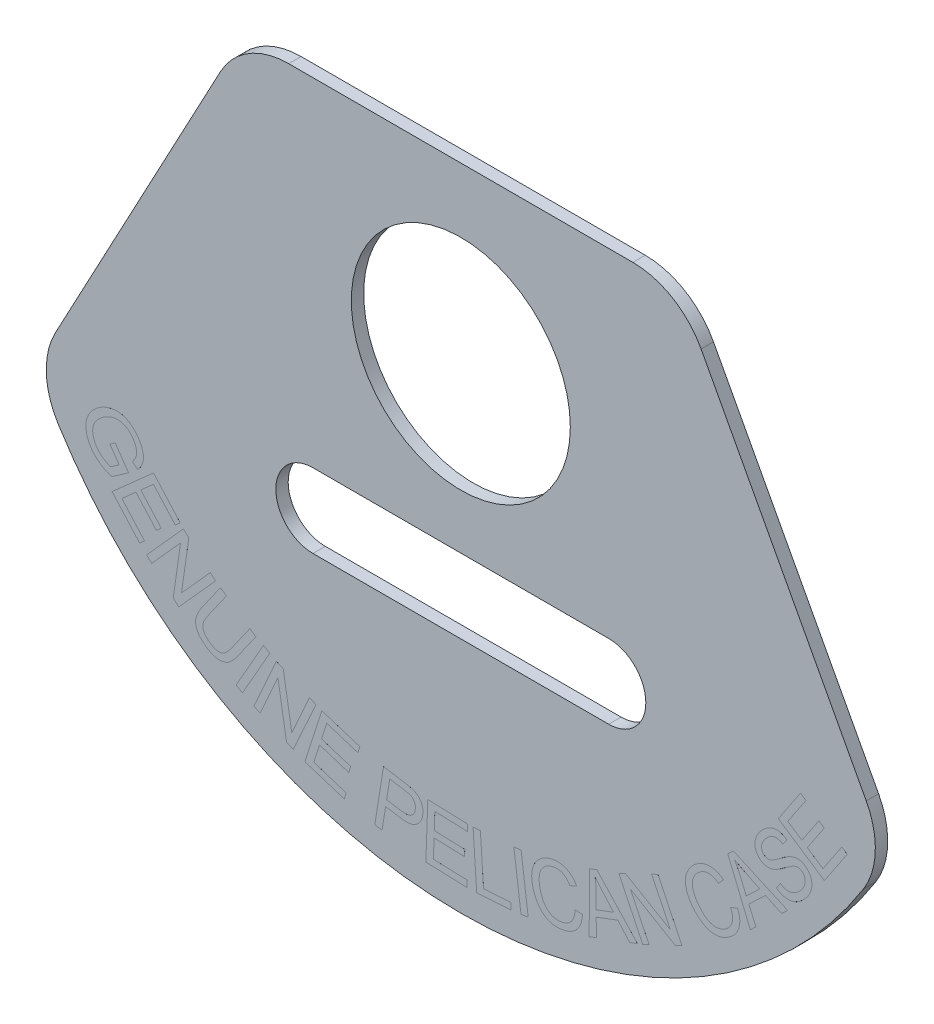
from build123d import *

# Parameters (mm, degrees)
SKETCH1_R      = 4.4958
EXTRUDE1_DEPTH = 0.508
FILLET1_R      = 3.175
EXTRUDE2_DEPTH = 0.0001016


with BuildPart() as part:
    # Sketch1 → Extrude1 (new body)
    with BuildSketch(Plane.XY):
        with BuildLine():
            Line((-8.9662, 7.1374), (8.9662, 7.1374))
            Line((8.9662, 7.1374), (17.4625, -8.751203146))
            ThreePointArc((17.4625, -8.751203146), (0, -19.5326), (-17.4625, -8.751203146))
            Line((-17.4625, -8.751203146), (-8.9662, 7.1374))
        make_face()
        Circle(SKETCH1_R, mode=Mode.SUBTRACT)
        with BuildLine():
            Line((-6.0706, -9.779), (6.0706, -9.779))
            ThreePointArc((6.0706, -9.779), (7.5946, -8.255), (6.0706, -6.731))
            Line((6.0706, -6.731), (-6.0706, -6.731))
            ThreePointArc((-6.0706, -6.731), (-7.5946, -8.255), (-6.0706, -9.779))
        make_face(mode=Mode.SUBTRACT)
    extrude(amount=EXTRUDE1_DEPTH)

    # Fillet1
    fillet1_edges = [part.edges().sort_by_distance(p)[0] for p in [
        (-8.9662, 7.1374, 0.254),
        (8.9662, 7.1374, 0.254),
        (17.4625, -8.751203146, 0.254),
        (-17.4625, -8.751203146, 0.254),
    ]]
    fillet(fillet1_edges, radius=FILLET1_R)

    # Sketch2 → Extrude2 (add)
    # profile 1 of 18: a face of its own
    with BuildSketch(Plane.XY.offset(0.508)):
        with BuildLine():
            Line((-14.405339403, -10.058231939), (-14.185989643, -9.906198285))
            Line((-14.185989643, -9.906198285), (-13.637386278, -10.697048045))
            Line((-13.637386278, -10.697048045), (-14.330238442, -11.176503574))
            add(Edge.make_bspline(
                [(-14.330238442, -11.176503574), (-14.374317038, -11.162431883), (-14.461095163, -11.134728755), (-14.584628046, -11.08119479), (-14.701253634, -11.022163996), (-14.809199189, -10.954077311), (-14.908909301, -10.878158018), (-15.000914825, -10.795215031), (-15.084475824, -10.704335145), (-15.13297946, -10.638144671), (-15.157264884, -10.605003574)],
                knots=[0, 0, 0, 0, 1.082828154, 2.131778334, 3.148468589, 4.141125326, 5.115499049, 6.079637879, 7.038488401, 8, 8, 8, 8], degree=3))
            add(Edge.make_bspline(
                [(-15.157264884, -10.605003574), (-15.172667622, -10.582138048), (-15.20312692, -10.536920903), (-15.243383735, -10.466407882), (-15.27911171, -10.395213103), (-15.310007636, -10.322872484), (-15.336036317, -10.249586481), (-15.357789537, -10.175346042), (-15.374096109, -10.100014745), (-15.386244522, -10.024224904), (-15.392589965, -9.948455948), (-15.393549061, -9.873469325), (-15.389109571, -9.799494471), (-15.37851616, -9.726773966), (-15.362326661, -9.655310303), (-15.340828579, -9.584953959), (-15.313207725, -9.515832174), (-15.280210241, -9.448082287), (-15.24215693, -9.382295981), (-15.199870647, -9.318704936), (-15.154230986, -9.256953391), (-15.103480356, -9.198427879), (-15.049113219, -9.141933601), (-14.990169046, -9.088549238), (-14.927870718, -9.03670423), (-14.883478591, -9.005016951), (-14.860982432, -8.988959103)],
                knots=[0, 0, 0, 0, 1.071349796, 2.118620868, 3.153497963, 4.166333753, 5.174134211, 6.174993909, 7.171252578, 8.168217763, 9.156671421, 10.123900765, 11.081031277, 12.034273283, 12.977117325, 13.926807141, 14.890901093, 15.867458189, 16.85364755, 17.842688721, 18.834768701, 19.836173477, 20.851647588, 21.880605348, 22.925975333, 24, 24, 24, 24], degree=3))
            add(Edge.make_bspline(
                [(-14.860982432, -8.988959103), (-14.838241078, -8.973756356), (-14.79303418, -8.943535242), (-14.722888771, -8.902783183), (-14.651236151, -8.866621054), (-14.578439378, -8.834353689), (-14.504015942, -8.806989637), (-14.428566913, -8.783497182), (-14.35160695, -8.764742502), (-14.273986089, -8.750109715), (-14.196322699, -8.740289218), (-14.119607683, -8.736495822), (-14.044642593, -8.73908451), (-13.971183342, -8.745907687), (-13.899618063, -8.760097218), (-13.829358216, -8.779085421), (-13.760986975, -8.804506533), (-13.694499435, -8.835328036), (-13.62976656, -8.871141988), (-13.567274208, -8.911826977), (-13.506952469, -8.957068073), (-13.448683797, -9.006464169), (-13.392971736, -9.060849864), (-13.338522939, -9.118841111), (-13.287422938, -9.182343278), (-13.255270108, -9.226936518), (-13.238984836, -9.249522805)],
                knots=[0, 0, 0, 0, 1.06109204, 2.109315031, 3.144864666, 4.173686793, 5.1967489, 6.219502437, 7.237857309, 8.268110154, 9.282514121, 10.272633808, 11.244304441, 12.1906689, 13.131439513, 14.071035106, 15.011619306, 15.957557495, 16.911819532, 17.879312396, 18.848163653, 19.835445603, 20.84059366, 21.867231811, 22.919761968, 24, 24, 24, 24], degree=3))
            add(Edge.make_bspline(
                [(-13.238984836, -9.249522805), (-13.217026873, -9.283052671), (-13.173964625, -9.348808837), (-13.120628801, -9.451534592), (-13.079592915, -9.555524793), (-13.049706613, -9.659142756), (-13.032087419, -9.761288222), (-13.026717651, -9.85985298), (-13.033741207, -9.954355959), (-13.054325775, -10.045318008), (-13.088376107, -10.133897693), (-13.134144469, -10.222427494), (-13.193315193, -10.311207936), (-13.240268109, -10.367760507), (-13.264629067, -10.397102132)],
                knots=[0, 0, 0, 0, 1.149350684, 2.25401714, 3.313617248, 4.351853787, 5.34248913, 6.280872132, 7.176969563, 8.052379664, 8.946259361, 9.892254739, 10.906421622, 12, 12, 12, 12], degree=3))
            Line((-13.264629067, -10.397102132), (-13.479399499, -10.216676651))
            add(Edge.make_bspline(
                [(-13.479399499, -10.216676651), (-13.461801722, -10.19387973), (-13.428130687, -10.150260817), (-13.385422093, -10.083860239), (-13.351787839, -10.020243482), (-13.32718509, -9.95817553), (-13.311252187, -9.895111236), (-13.305935452, -9.829054408), (-13.308081069, -9.759383655), (-13.319990733, -9.686962008), (-13.339596025, -9.612977897), (-13.367464427, -9.539147362), (-13.404577496, -9.466599632), (-13.434696951, -9.420526392), (-13.450091807, -9.396977132)],
                knots=[0, 0, 0, 0, 1.158737033, 2.217091143, 3.173407836, 4.050779318, 4.898657467, 5.780855778, 6.70909061, 7.697969566, 8.727743783, 9.785527082, 10.868123942, 12, 12, 12, 12], degree=3))
            add(Edge.make_bspline(
                [(-13.450091807, -9.396977132), (-13.469627725, -9.370055371), (-13.5074582, -9.317922525), (-13.569957717, -9.248079516), (-13.634766855, -9.188233913), (-13.702210746, -9.139197982), (-13.770955253, -9.099760411), (-13.839379402, -9.068072665), (-13.908566817, -9.046412839), (-13.977288973, -9.033135637), (-14.045440377, -9.027553293), (-14.112663789, -9.026877872), (-14.179066577, -9.032202317), (-14.222527739, -9.040327273), (-14.244147095, -9.044368959)],
                knots=[0, 0, 0, 0, 1.290977427, 2.49992288, 3.632681347, 4.710382453, 5.730109379, 6.70630512, 7.632375366, 8.53794066, 9.418565077, 10.283977416, 11.146380324, 12, 12, 12, 12], degree=3))
            add(Edge.make_bspline(
                [(-14.244147095, -9.044368959), (-14.281039209, -9.053463158), (-14.355321615, -9.071774362), (-14.462890006, -9.114677234), (-14.56889642, -9.166964712), (-14.635346164, -9.210776755), (-14.669108634, -9.233037228)],
                knots=[0, 0, 0, 0, 0.973568992, 1.960284718, 2.963640486, 4, 4, 4, 4], degree=3))
            add(Edge.make_bspline(
                [(-14.669108634, -9.233037228), (-14.689434119, -9.247302802), (-14.729317086, -9.275294921), (-14.784889378, -9.320395839), (-14.836695517, -9.365758157), (-14.883593821, -9.412423027), (-14.92671287, -9.459597278), (-14.964443858, -9.508333401), (-14.998851339, -9.55733808), (-15.028004752, -9.607707115), (-15.052830424, -9.658724699), (-15.073556527, -9.710267755), (-15.090313132, -9.762352422), (-15.101551631, -9.815334979), (-15.108950095, -9.868592661), (-15.112261086, -9.922489194), (-15.110864999, -9.977031528), (-15.102691309, -10.050028258), (-15.083680144, -10.139773079), (-15.049869142, -10.244115524), (-15.003407426, -10.343892737), (-14.963821278, -10.405759108), (-14.943868249, -10.436942276)],
                knots=[0, 0, 0, 0, 1.063172158, 2.086172138, 3.063384936, 4.011024092, 4.91822726, 5.798339324, 6.648817758, 7.480778533, 8.287732388, 9.076799311, 9.858328981, 10.627678796, 11.393186153, 12.159418925, 12.937605783, 13.726672705, 15.302380997, 16.856996345, 18.415798284, 20, 20, 20, 20], degree=3))
            add(Edge.make_bspline(
                [(-14.943868249, -10.436942276), (-14.924694115, -10.463007968), (-14.886306356, -10.515193037), (-14.819270568, -10.586005485), (-14.745815735, -10.651014015), (-14.666665668, -10.707810363), (-14.587171519, -10.75689783), (-14.511146086, -10.796634682), (-14.441017728, -10.828285524), (-14.3946764, -10.841484502), (-14.372826182, -10.847707901)],
                knots=[0, 0, 0, 0, 1.083356329, 2.16894396, 3.259712218, 4.365640272, 5.428827185, 6.387401207, 7.239649868, 8, 8, 8, 8], degree=3))
            Line((-14.372826182, -10.847707901), (-14.025255268, -10.607293237))
            Line((-14.025255268, -10.607293237), (-14.405339403, -10.058231939))
        make_face()
    # profile 2 of 18: a face of its own
    with BuildSketch(Plane.XY.offset(0.508)):
        Polygon((-14.315110361, -11.701254233), (-12.61572214, -10.186870819), (-11.520805073, -11.415504233), (-11.721379592, -11.594097983), (-12.61572214, -10.590309521), (-13.136391611, -11.054653271), (-12.298832717, -11.994789088), (-12.498033438, -12.17200904), (-13.335592333, -11.231873223), (-13.913961323, -11.747505434), (-12.984357958, -12.790676108), (-13.184932477, -12.969269858), align=None)
    # profile 3 of 18: a face of its own
    with BuildSketch(Plane.XY.offset(0.508)):
        Polygon((-12.899613787, -13.246794117), (-11.393473162, -11.5684708), (-11.165422682, -11.773166713), (-11.466284461, -13.881488829), (-10.283902249, -12.564016473), (-10.070963547, -12.755432338), (-11.577104172, -14.433755656), (-11.805154653, -14.229059742), (-11.503377009, -12.118905896), (-12.686675086, -13.43775205), align=None)
    # profile 4 of 18: a face of its own
    with BuildSketch(Plane.XY.offset(0.508)):
        with BuildLine():
            Line((-8.658962879, -13.742428072), (-8.414426821, -13.914152832))
            Line((-8.414426821, -13.914152832), (-9.164520571, -14.981136005))
            add(Edge.make_bspline(
                [(-9.164520571, -14.981136005), (-9.180554719, -15.003531159), (-9.211858288, -15.047253362), (-9.259995554, -15.109259175), (-9.306805042, -15.166990668), (-9.354531724, -15.218491189), (-9.400236816, -15.266418498), (-9.446231967, -15.308652355), (-9.491699974, -15.345883073), (-9.53676014, -15.378761494), (-9.582454497, -15.407241349), (-9.6301531, -15.430612128), (-9.679435275, -15.450238811), (-9.730507285, -15.466121307), (-9.783489934, -15.476738328), (-9.83821607, -15.484489148), (-9.894901125, -15.486698781), (-9.953216833, -15.486196738), (-10.01284482, -15.480161576), (-10.073493097, -15.468599415), (-10.135157245, -15.451444907), (-10.197669115, -15.428919103), (-10.261415098, -15.401296085), (-10.32558395, -15.367697862), (-10.391206224, -15.329160393), (-10.433931974, -15.29982317), (-10.455890764, -15.28474538)],
                knots=[0, 0, 0, 0, 1.293593689, 2.525491211, 3.68678287, 4.783040747, 5.822468747, 6.796722181, 7.71384446, 8.581512773, 9.415250618, 10.239313701, 11.072774039, 11.905123425, 12.747418629, 13.608306321, 14.498405806, 15.40908752, 16.345814629, 17.309057097, 18.305767063, 19.348971628, 20.427882632, 21.566284166, 22.749197998, 24, 24, 24, 24], degree=3))
            add(Edge.make_bspline(
                [(-10.455890764, -15.28474538), (-10.476797039, -15.269676397), (-10.517780249, -15.240136208), (-10.57548308, -15.193446116), (-10.628152704, -15.145830264), (-10.675948615, -15.097756563), (-10.718784464, -15.048981421), (-10.756986605, -14.999595747), (-10.789993872, -14.949183162), (-10.818137135, -14.898033793), (-10.841507152, -14.846465626), (-10.860046411, -14.794221507), (-10.873672877, -14.741647263), (-10.883160071, -14.688539765), (-10.887065023, -14.635010368), (-10.886658051, -14.581092067), (-10.881525133, -14.52687526), (-10.871861416, -14.47186463), (-10.856815067, -14.415466875), (-10.837059005, -14.357112059), (-10.812676349, -14.296379931), (-10.783051685, -14.233544204), (-10.748908835, -14.168165821), (-10.708998823, -14.100877453), (-10.665448648, -14.030701983), (-10.633171675, -13.984228367), (-10.616625139, -13.960404034)],
                knots=[0, 0, 0, 0, 1.198902994, 2.350246126, 3.451451591, 4.501062542, 5.502571623, 6.469956215, 7.403670972, 8.303212774, 9.183712099, 10.035056661, 10.879141932, 11.70815304, 12.541563724, 13.372549936, 14.214241483, 15.072460762, 15.968237716, 16.927243352, 17.937477943, 19.011412202, 20.158233961, 21.367797059, 22.650621879, 24, 24, 24, 24], degree=3))
            Line((-10.616625139, -13.960404034), (-9.866531389, -12.893420861))
            Line((-9.866531389, -12.893420861), (-9.622453264, -13.06514562))
            Line((-9.622453264, -13.06514562), (-10.371631148, -14.130754995))
            add(Edge.make_bspline(
                [(-10.371631148, -14.130754995), (-10.385226369, -14.150185274), (-10.41149531, -14.187728822), (-10.446910547, -14.243868182), (-10.479246117, -14.296205357), (-10.506822458, -14.345903565), (-10.530335074, -14.392598014), (-10.549575795, -14.436476678), (-10.564968321, -14.477382673), (-10.579565795, -14.527434304), (-10.589471057, -14.588396301), (-10.587969399, -14.660931006), (-10.574058049, -14.732568894), (-10.546925039, -14.802453851), (-10.508189944, -14.870074101), (-10.457338436, -14.934244855), (-10.39523642, -14.994953282), (-10.347357986, -15.030534831), (-10.32263235, -15.048910043)],
                knots=[0, 0, 0, 0, 1.066459632, 2.060633316, 2.984954202, 3.833192619, 4.616151469, 5.335575481, 5.98727313, 6.580469746, 7.678743022, 8.749987629, 9.827178094, 10.94415533, 12.106566386, 13.319326695, 14.615632408, 16, 16, 16, 16], degree=3))
            add(Edge.make_bspline(
                [(-10.32263235, -15.048910043), (-10.300729402, -15.063934684), (-10.258579526, -15.092847994), (-10.19385105, -15.128742783), (-10.132251054, -15.159366783), (-10.071912771, -15.181129525), (-10.014110089, -15.197022978), (-9.958191161, -15.204026006), (-9.90448323, -15.205610034), (-9.852085056, -15.198515463), (-9.799945778, -15.182989817), (-9.747413731, -15.157574433), (-9.693671989, -15.122720594), (-9.638691501, -15.078289231), (-9.582537876, -15.02450558), (-9.525115915, -14.961119587), (-9.466235253, -14.888405), (-9.428032035, -14.835554907), (-9.408140764, -14.808037447)],
                knots=[0, 0, 0, 0, 1.148662931, 2.210478747, 3.200176775, 4.121732785, 4.982075457, 5.788277587, 6.554609765, 7.301012076, 8.065919579, 8.899134267, 9.817108826, 10.832182822, 11.953494772, 13.17849417, 14.530926453, 16, 16, 16, 16], degree=3))
            Line((-9.408140764, -14.808037447), (-8.658962879, -13.742428072))
        make_face()
    # profile 5 of 18: a face of its own
    with BuildSketch(Plane.XY.offset(0.508)):
        Polygon((-9.224750098, -16.033475363), (-8.100067406, -14.06161719), (-7.839045771, -14.210445315), (-8.963728464, -16.182303488), align=None)
    # profile 6 of 18: a face of its own
    with BuildSketch(Plane.XY.offset(0.508)):
        Polygon((-8.49737474, -16.418323818), (-7.56868724, -14.36220603), (-7.28980623, -14.48813752), (-6.939029788, -16.590048578), (-6.210000942, -14.975835837), (-5.948979307, -15.093524539), (-6.877666807, -17.149642328), (-7.156547817, -17.023710837), (-7.507324259, -14.920425982), (-8.236811038, -16.53601252), align=None)
    # profile 7 of 18: a face of its own
    with BuildSketch(Plane.XY.offset(0.508)):
        Polygon((-6.399236985, -17.34597979), (-5.705468956, -15.184995415), (-4.14300261, -15.686431713), (-4.224972562, -15.941500223), (-5.501230975, -15.532108396), (-5.713711744, -16.193821136), (-4.518507417, -16.577568732), (-4.600019437, -16.831263444), (-5.795223763, -16.447515848), (-6.0310591, -17.182955751), (-4.70442809, -17.608833155), (-4.786398042, -17.863901665), align=None)
    # profile 8 of 18: a face of its own
    with BuildSketch(Plane.XY.offset(0.508)):
        with BuildLine():
            Line((-3.528899293, -18.151400153), (-3.173085591, -15.906614096))
            Line((-3.173085591, -15.906614096), (-2.326368043, -16.040788375))
            add(Edge.make_bspline(
                [(-2.326368043, -16.040788375), (-2.291206952, -16.046457005), (-2.225422037, -16.057062774), (-2.134022494, -16.076109883), (-2.056018841, -16.094563422), (-2.009254316, -16.10953059), (-1.987955783, -16.116347269)],
                knots=[0, 0, 0, 0, 1.230998269, 2.303145796, 3.227181147, 4, 4, 4, 4], degree=3))
            add(Edge.make_bspline(
                [(-1.987955783, -16.116347269), (-1.962247406, -16.125588072), (-1.912238831, -16.143563512), (-1.842969921, -16.178489588), (-1.78140176, -16.218618449), (-1.727015246, -16.263727544), (-1.679950441, -16.315463957), (-1.640097312, -16.373963535), (-1.606867918, -16.439415513), (-1.580798946, -16.510753455), (-1.561678284, -16.586358884), (-1.552948813, -16.665140657), (-1.551957043, -16.745985721), (-1.558977134, -16.800087304), (-1.562536312, -16.82751674)],
                knots=[0, 0, 0, 0, 1.079371308, 2.099619911, 3.05879341, 3.979901094, 4.885636132, 5.814717048, 6.770218928, 7.78034947, 8.812312397, 9.845386564, 10.907613645, 12, 12, 12, 12], degree=3))
            add(Edge.make_bspline(
                [(-1.562536312, -16.82751674), (-1.56669927, -16.850810107), (-1.574918461, -16.896799672), (-1.594267818, -16.963208122), (-1.619119932, -17.025844001), (-1.649140239, -17.08477854), (-1.683747156, -17.140483613), (-1.724608605, -17.192073131), (-1.770372638, -17.24012502), (-1.821343481, -17.284583821), (-1.879163615, -17.323934663), (-1.945624339, -17.354948367), (-2.020317082, -17.377608963), (-2.102935037, -17.39292501), (-2.193692905, -17.401119859), (-2.29260403, -17.400378925), (-2.399569517, -17.393274094), (-2.473117235, -17.38259215), (-2.51137285, -17.377035971)],
                knots=[0, 0, 0, 0, 0.906692838, 1.790140875, 2.64648238, 3.486613042, 4.322821085, 5.156383251, 6.00495072, 6.863788182, 7.745140347, 8.677091179, 9.663684233, 10.729955719, 11.89346753, 13.15168826, 14.518459555, 16, 16, 16, 16], degree=3))
            Line((-2.51137285, -17.377035971), (-3.086994245, -17.285907365))
            Line((-3.086994245, -17.285907365), (-3.231700975, -18.198567221))
            Line((-3.231700975, -18.198567221), (-3.528899293, -18.151400153))
        make_face()
        with BuildLine():
            Line((-3.044864437, -17.021222269), (-2.464663716, -17.112808807))
            add(Edge.make_bspline(
                [(-2.464663716, -17.112808807), (-2.441488001, -17.116065086), (-2.3967698, -17.122348168), (-2.331671661, -17.128149645), (-2.271224351, -17.129079779), (-2.215476587, -17.126080991), (-2.164422592, -17.11884361), (-2.11774777, -17.107672433), (-2.075984789, -17.091591953), (-2.0385367, -17.071656529), (-2.005527703, -17.047635449), (-1.975936159, -17.020364545), (-1.949724811, -16.98990924), (-1.926506806, -16.956302937), (-1.907435833, -16.918888939), (-1.891443859, -16.878394173), (-1.878301599, -16.834632426), (-1.872996265, -16.803929043), (-1.870267081, -16.788134528)],
                knots=[0, 0, 0, 0, 1.447166134, 2.792348232, 4.038500974, 5.182586258, 6.241196355, 7.223354705, 8.143690697, 9.001020958, 9.839381737, 10.661049305, 11.484233666, 12.31945321, 13.18072381, 14.074686747, 15.009575357, 16, 16, 16, 16], degree=3))
            add(Edge.make_bspline(
                [(-1.870267081, -16.788134528), (-1.86745077, -16.765278693), (-1.861976664, -16.720853469), (-1.865243489, -16.654949155), (-1.878595161, -16.592770063), (-1.901621034, -16.535042484), (-1.932534999, -16.482789244), (-1.971089629, -16.437541302), (-2.016980379, -16.400025538), (-2.052142269, -16.382241804), (-2.069925735, -16.373247509)],
                knots=[0, 0, 0, 0, 1.112415947, 2.162219244, 3.174583528, 4.175546554, 5.155703217, 6.09837325, 7.038233875, 8, 8, 8, 8], degree=3))
            add(Edge.make_bspline(
                [(-2.069925735, -16.373247509), (-2.076628162, -16.370617899), (-2.091149479, -16.36492065), (-2.115124915, -16.356434557), (-2.143405307, -16.349042954), (-2.175661646, -16.34131258), (-2.211728098, -16.332808617), (-2.252180604, -16.32545315), (-2.296482624, -16.316843296), (-2.327569658, -16.312078077), (-2.343769485, -16.309594865)],
                knots=[0, 0, 0, 0, 0.613410229, 1.3289997, 2.165023631, 3.101782561, 4.155449544, 5.320983391, 6.603932319, 8, 8, 8, 8], degree=3))
            Line((-2.343769485, -16.309594865), (-2.918017081, -16.218924192))
            Line((-2.918017081, -16.218924192), (-3.044864437, -17.021222269))
        make_face(mode=Mode.SUBTRACT)
    # profile 9 of 18: a face of its own
    with BuildSketch(Plane.XY.offset(0.508)):
        Polygon((-1.435005312, -18.433020669), (-1.355782956, -16.167169708), (0.282242284, -16.224411294), (0.273083631, -16.491843987), (-1.064995696, -16.445134852), (-1.089266129, -17.138902881), (0.16409565, -17.182864419), (0.154479063, -17.448923314), (-1.098882716, -17.404961775), (-1.125900744, -18.176120429), (0.264840842, -18.225119227), (0.255682188, -18.492551919), align=None)
    # profile 10 of 18: a face of its own
    with BuildSketch(Plane.XY.offset(0.508)):
        Polygon((0.652634117, -18.480897071), (0.501974261, -16.21504611), (0.801920175, -16.195355004), (0.934720655, -18.193773273), (2.050702626, -18.119588177), (2.068562001, -18.387020869), align=None)
    # profile 11 of 18: a face of its own
    with BuildSketch(Plane.XY.offset(0.508)):
        Polygon((2.470258213, -18.334643672), (2.178555088, -16.089857614), (2.475295473, -16.051391268), (2.766998598, -18.296177326), align=None)
    # profile 12 of 18: a face of its own
    with BuildSketch(Plane.XY.offset(0.508)):
        with BuildLine():
            Line((4.683898787, -17.067801948), (4.991629556, -17.076044737))
            add(Edge.make_bspline(
                [(4.991629556, -17.076044737), (4.990267651, -17.107069501), (4.987602387, -17.167785316), (4.97573623, -17.25649276), (4.95914888, -17.340932132), (4.936179668, -17.421064626), (4.907179229, -17.496802604), (4.872980527, -17.568577794), (4.83238755, -17.635831603), (4.78603177, -17.698493709), (4.734876739, -17.756745136), (4.678630066, -17.809628832), (4.617943614, -17.857419095), (4.552576823, -17.900285395), (4.482386145, -17.937610321), (4.407823341, -17.970449045), (4.328389864, -17.997486406), (4.273246039, -18.011092216), (4.245199268, -18.018012285)],
                knots=[0, 0, 0, 0, 1.139920093, 2.230836531, 3.2829108, 4.297753831, 5.287802245, 6.258086648, 7.213670283, 8.167773029, 9.116972452, 10.0567901, 10.998795179, 11.950309081, 12.923374602, 13.914866062, 14.93947735, 16, 16, 16, 16], degree=3))
            add(Edge.make_bspline(
                [(4.245199268, -18.018012285), (4.216107617, -18.024158185), (4.159256159, -18.036168621), (4.074815857, -18.047978676), (3.993615553, -18.054585361), (3.915425843, -18.055577048), (3.840242859, -18.051166527), (3.768182707, -18.040935977), (3.699062824, -18.02620391), (3.633362589, -18.004718029), (3.570332091, -17.97870684), (3.510121045, -17.947100514), (3.45192464, -17.911589474), (3.396230889, -17.870961162), (3.342948487, -17.825649237), (3.292679074, -17.774773068), (3.24397475, -17.720034548), (3.198480488, -17.66038373), (3.155583884, -17.597605893), (3.11639997, -17.53194461), (3.079870993, -17.464623762), (3.047613535, -17.39464686), (3.017617649, -17.323027456), (2.991759911, -17.249062328), (2.968409464, -17.173421621), (2.956278337, -17.12176498), (2.950165614, -17.095735842)],
                knots=[0, 0, 0, 0, 1.1867565, 2.319182131, 3.401179916, 4.437222959, 5.438486803, 6.404584374, 7.340536401, 8.255948174, 9.160196593, 10.059647795, 10.967891575, 11.879644938, 12.808987165, 13.75698317, 14.732700359, 15.732182329, 16.749707612, 17.766594003, 18.78357169, 19.805921335, 20.841426574, 21.882225988, 22.932880079, 24, 24, 24, 24], degree=3))
            add(Edge.make_bspline(
                [(2.950165614, -17.095735842), (2.944219589, -17.067398777), (2.932504766, -17.011569262), (2.920317798, -16.928078716), (2.91223929, -16.846482463), (2.909592236, -16.766644157), (2.911377927, -16.688668141), (2.917598684, -16.612454126), (2.929207636, -16.538145432), (2.945118148, -16.465753617), (2.965726575, -16.395865072), (2.990362357, -16.328719916), (3.019715973, -16.264838015), (3.053869679, -16.204246614), (3.091836045, -16.146461582), (3.13405645, -16.091634907), (3.181112155, -16.040387331), (3.231701919, -15.991798589), (3.286242623, -15.947274665), (3.343148368, -15.905799454), (3.402623524, -15.868249044), (3.464694202, -15.834829056), (3.529031329, -15.804906842), (3.595838959, -15.778829505), (3.665160251, -15.756734664), (3.71254885, -15.745169078), (3.736436046, -15.739339208)],
                knots=[0, 0, 0, 0, 1.179188224, 2.323229468, 3.435050269, 4.517606333, 5.57494036, 6.610774557, 7.629996705, 8.636238979, 9.627870754, 10.595786893, 11.547286753, 12.488224394, 13.426384429, 14.361655271, 15.303578531, 16.257918454, 17.21646236, 18.169160136, 19.124856245, 20.079135398, 21.038888569, 22.013432644, 22.998629946, 24, 24, 24, 24], degree=3))
            add(Edge.make_bspline(
                [(3.736436046, -15.739339208), (3.763538891, -15.733753181), (3.81685389, -15.722764703), (3.896633826, -15.713342046), (3.974227181, -15.709471412), (4.049712621, -15.711791585), (4.123173932, -15.719740425), (4.194420996, -15.734834281), (4.263892124, -15.754627953), (4.330699903, -15.781465753), (4.394861991, -15.813501723), (4.45597452, -15.850738012), (4.513984797, -15.893032801), (4.568644884, -15.940736804), (4.619489566, -15.994203881), (4.667127445, -16.052592206), (4.712027786, -16.115811414), (4.738007743, -16.161316737), (4.751214893, -16.184449785)],
                knots=[0, 0, 0, 0, 1.107730879, 2.179057969, 3.213260117, 4.216207806, 5.200408562, 6.167857126, 7.129261741, 8.089558063, 9.046346086, 9.99824002, 10.95189872, 11.917955882, 12.899362255, 13.902756907, 14.933847251, 16, 16, 16, 16], degree=3))
            Line((4.751214893, -16.184449785), (4.479202873, -16.3163344))
            add(Edge.make_bspline(
                [(4.479202873, -16.3163344), (4.46824487, -16.29835813), (4.446904015, -16.26334911), (4.412659585, -16.214159112), (4.376619103, -16.169985905), (4.339687497, -16.129944027), (4.301118991, -16.094727793), (4.261781435, -16.06360339), (4.22057899, -16.037932638), (4.178330347, -16.016234627), (4.134630673, -15.998781831), (4.089428426, -15.985329408), (4.04261617, -15.976404792), (3.994405962, -15.970713142), (3.944620763, -15.9695869), (3.893198958, -15.971830783), (3.840050606, -15.978165732), (3.804467945, -15.985590215), (3.78635071, -15.989370458)],
                knots=[0, 0, 0, 0, 1.215758026, 2.367704666, 3.458166423, 4.506104943, 5.510687657, 6.471778229, 7.398786008, 8.309554459, 9.211576862, 10.112564735, 11.028905509, 11.960596443, 12.913076665, 13.901436497, 14.931497306, 16, 16, 16, 16], degree=3))
            add(Edge.make_bspline(
                [(3.78635071, -15.989370458), (3.76565769, -15.994411093), (3.725117179, -16.0042864), (3.66685945, -16.023953864), (3.611618017, -16.045530324), (3.560256734, -16.071346027), (3.512346787, -16.100315475), (3.467776523, -16.132472626), (3.42642835, -16.167704698), (3.388805688, -16.206258701), (3.35525901, -16.247486682), (3.32452834, -16.290121088), (3.298527622, -16.335234988), (3.276123088, -16.382173707), (3.256552797, -16.430794077), (3.241590988, -16.481580083), (3.23067019, -16.534313763), (3.220453007, -16.606626502), (3.215247699, -16.698336167), (3.217648811, -16.808385365), (3.228079671, -16.918184152), (3.242749008, -16.990362034), (3.250111527, -17.026588006)],
                knots=[0, 0, 0, 0, 0.964775238, 1.89012928, 2.784209704, 3.650451979, 4.491608875, 5.319114562, 6.13848389, 6.950549192, 7.756581148, 8.545480362, 9.329755774, 10.112565362, 10.901312909, 11.702401846, 12.50831505, 13.339887837, 15.010297407, 16.664007069, 18.325670115, 20, 20, 20, 20], degree=3))
            add(Edge.make_bspline(
                [(3.250111527, -17.026588006), (3.255614567, -17.049520612), (3.266484906, -17.09482016), (3.285039476, -17.161089989), (3.306329169, -17.224373685), (3.329021464, -17.285029158), (3.354394824, -17.342653795), (3.381098507, -17.397780993), (3.410842445, -17.449596212), (3.441527123, -17.499078997), (3.47489779, -17.544973276), (3.510829695, -17.586681743), (3.54828974, -17.624828566), (3.587822993, -17.659028729), (3.629799972, -17.6888571), (3.673689466, -17.715039766), (3.719878079, -17.737116623), (3.783461005, -17.761306235), (3.865483293, -17.781757599), (3.965310104, -17.794202882), (4.066107092, -17.792125716), (4.132202984, -17.780030712), (4.165518979, -17.77393416)],
                knots=[0, 0, 0, 0, 1.058116216, 2.09013256, 3.086395762, 4.053124268, 4.994707355, 5.910531649, 6.79995685, 7.674034748, 8.52199046, 9.342850422, 10.141935794, 10.918968454, 11.684874452, 12.449523935, 13.2092192, 13.978760533, 15.498675794, 16.988701243, 18.482138398, 20, 20, 20, 20], degree=3))
            add(Edge.make_bspline(
                [(4.165518979, -17.77393416), (4.185455633, -17.769073465), (4.224724642, -17.759499408), (4.281122311, -17.739701097), (4.334026442, -17.715739044), (4.383651124, -17.688177751), (4.430220073, -17.657139137), (4.472866812, -17.621524506), (4.512541024, -17.582442031), (4.548734003, -17.539474826), (4.58076283, -17.492592945), (4.608891202, -17.442364507), (4.632789479, -17.388611084), (4.652035816, -17.33109876), (4.666441146, -17.270044441), (4.677097351, -17.205653744), (4.682960392, -17.13782425), (4.683581568, -17.091472557), (4.683898787, -17.067801948)],
                knots=[0, 0, 0, 0, 1.027978405, 2.024797807, 2.990331591, 3.935496082, 4.866969722, 5.790651106, 6.715693756, 7.655050777, 8.60145288, 9.557024747, 10.53652023, 11.545332886, 12.591846607, 13.677232864, 14.813823045, 16, 16, 16, 16], degree=3))
        make_face()
    # profile 13 of 18: a face of its own
    with BuildSketch(Plane.XY.offset(0.508)):
        Polygon((5.269462256, -17.735120518), (5.282742304, -15.308993114), (5.584519948, -15.194967874), (7.252310814, -16.986400566), (6.932673794, -17.106836864), (6.443601679, -16.558691432), (5.557501919, -16.89344023), (5.567118506, -17.622927008), align=None)
        with BuildLine():
            Line((5.552006727, -16.634250326), (6.270045189, -16.363154172))
            Line((6.270045189, -16.363154172), (5.827224275, -15.85942821))
            add(Edge.make_bspline(
                [(5.827224275, -15.85942821), (5.810850967, -15.840840672), (5.778882336, -15.804548792), (5.732706589, -15.75077263), (5.68865407, -15.699817985), (5.647955923, -15.650636735), (5.609823168, -15.604022143), (5.574832423, -15.559419422), (5.541403773, -15.518028975), (5.521077376, -15.49040772), (5.511250718, -15.477054412)],
                knots=[0, 0, 0, 0, 1.198132749, 2.339335591, 3.428476862, 4.456066177, 5.427000693, 6.341406839, 7.198164405, 8, 8, 8, 8], degree=3))
            add(Edge.make_bspline(
                [(5.511250718, -15.477054412), (5.516896278, -15.513649043), (5.528230424, -15.587117183), (5.539784975, -15.698519055), (5.548001166, -15.811227018), (5.549447943, -15.8868896), (5.550174996, -15.924912585)],
                knots=[0, 0, 0, 0, 0.987323473, 1.982171112, 2.985973307, 4, 4, 4, 4], degree=3))
            Line((5.550174996, -15.924912585), (5.552006727, -16.634250326))
        make_face(mode=Mode.SUBTRACT)
    # profile 14 of 18: a face of its own
    with BuildSketch(Plane.XY.offset(0.508)):
        Polygon((7.47256558, -16.91416547), (6.488926157, -14.879112585), (6.765059571, -14.745854172), (8.605948994, -15.826575326), (7.833874475, -14.228848162), (8.092148513, -14.10429047), (9.075787936, -16.139343354), (8.799654523, -16.272601768), (6.957849234, -15.190506816), (7.730839619, -16.789607778), align=None)
    # profile 15 of 18: a face of its own
    with BuildSketch(Plane.XY.offset(0.508)):
        with BuildLine():
            Line((11.075125829, -13.790220887), (11.361791694, -13.672990118))
            add(Edge.make_bspline(
                [(11.361791694, -13.672990118), (11.373066942, -13.701990963), (11.395180892, -13.758869818), (11.420277448, -13.845134632), (11.438129479, -13.92983099), (11.449948157, -14.012731941), (11.454158843, -14.094117296), (11.450883547, -14.173805699), (11.440784681, -14.251954851), (11.423950361, -14.328492744), (11.399957939, -14.40253287), (11.370268434, -14.474181914), (11.333215042, -14.542387252), (11.29069686, -14.608201037), (11.241289482, -14.670721583), (11.185604109, -14.730159989), (11.124146409, -14.787582638), (11.078946956, -14.8221641), (11.055892655, -14.839802618)],
                knots=[0, 0, 0, 0, 1.138181545, 2.232295727, 3.282884869, 4.303482608, 5.293416915, 6.260522151, 7.217998081, 8.173418954, 9.123764819, 10.062583306, 11.007216095, 11.960020985, 12.926593776, 13.918590269, 14.938362293, 16, 16, 16, 16], degree=3))
            add(Edge.make_bspline(
                [(11.055892655, -14.839802618), (11.031680155, -14.857211129), (10.984312596, -14.891267862), (10.911149634, -14.936046155), (10.838967721, -14.975166308), (10.767387016, -15.00783496), (10.696580821, -15.034205056), (10.62629899, -15.054082911), (10.556554514, -15.06730308), (10.487482732, -15.074819515), (10.419004771, -15.076066898), (10.350850436, -15.071993743), (10.283083856, -15.062164447), (10.215290386, -15.047688284), (10.148088714, -15.026771202), (10.081099885, -15.00105661), (10.014230038, -14.970311439), (9.948469247, -14.933628342), (9.883742341, -14.893009099), (9.820733423, -14.849073462), (9.760550302, -14.801260975), (9.701956831, -14.750932138), (9.646247319, -14.69658002), (9.592113016, -14.6395987), (9.540704871, -14.578847931), (9.508359916, -14.536486013), (9.492052511, -14.515128339)],
                knots=[0, 0, 0, 0, 1.184865367, 2.317983663, 3.406436538, 4.446259995, 5.442481932, 6.406655825, 7.345434702, 8.260609076, 9.164737594, 10.064274784, 10.97114694, 11.883844628, 12.816507104, 13.765172549, 14.734220269, 15.738903623, 16.755604276, 17.770493273, 18.789995631, 19.809299412, 20.839003514, 21.88186657, 22.932097413, 24, 24, 24, 24], degree=3))
            add(Edge.make_bspline(
                [(9.492052511, -14.515128339), (9.475171286, -14.491481518), (9.441948119, -14.444943292), (9.396979823, -14.373254185), (9.357134964, -14.301380875), (9.322087976, -14.229297925), (9.292289763, -14.156802927), (9.267346156, -14.084080596), (9.248364551, -14.010966309), (9.233279942, -13.938133485), (9.224413358, -13.865536006), (9.219979893, -13.793790506), (9.221482935, -13.723215947), (9.227909394, -13.653742382), (9.239228681, -13.58524151), (9.256452868, -13.517830652), (9.278188269, -13.451224817), (9.306128787, -13.386393245), (9.337313305, -13.322835217), (9.373240656, -13.261947566), (9.412728048, -13.20342371), (9.456408383, -13.147633896), (9.503470941, -13.093928835), (9.55464968, -13.043120591), (9.608986559, -12.994146981), (9.648136911, -12.964447662), (9.667898665, -12.949456464)],
                knots=[0, 0, 0, 0, 1.177876569, 2.318124953, 3.429070659, 4.508660626, 5.566094344, 6.605404087, 7.623261723, 8.627097568, 9.618955593, 10.586096377, 11.539433834, 12.478030784, 13.413131636, 14.351340775, 15.296688553, 16.250809253, 17.211292562, 18.165593919, 19.114904589, 20.071931725, 21.036712877, 22.008299491, 22.99465791, 24, 24, 24, 24], degree=3))
            add(Edge.make_bspline(
                [(9.667898665, -12.949456464), (9.690597542, -12.933439639), (9.735225356, -12.901949275), (9.804377207, -12.860571766), (9.874489201, -12.826143801), (9.944750798, -12.797473103), (10.015819739, -12.776079158), (10.087064597, -12.75997669), (10.15903988, -12.751683993), (10.231171377, -12.748654858), (10.303027456, -12.752484174), (10.37424995, -12.762104426), (10.444627106, -12.777664831), (10.514052967, -12.799743761), (10.582261605, -12.828485243), (10.649946806, -12.862381255), (10.716635831, -12.902729593), (10.759081336, -12.934003882), (10.780675107, -12.949914397)],
                knots=[0, 0, 0, 0, 1.107717559, 2.177861692, 3.209710966, 4.220348945, 5.200550507, 6.166584691, 7.129333199, 8.085805888, 9.042820883, 9.99504131, 10.949186339, 11.913761604, 12.896229095, 13.898119986, 14.930687343, 16, 16, 16, 16], degree=3))
            Line((10.780675107, -12.949914397), (10.584679915, -13.181628339))
            add(Edge.make_bspline(
                [(10.584679915, -13.181628339), (10.567416806, -13.169515516), (10.533671424, -13.145837751), (10.482012867, -13.114680237), (10.430879823, -13.088631496), (10.380989542, -13.066223751), (10.331350742, -13.049096223), (10.282197375, -13.037437003), (10.234038333, -13.02920471), (10.186444699, -13.026547501), (10.139399174, -13.028475883), (10.09251623, -13.034458902), (10.045787248, -13.04455891), (9.999174419, -13.058842906), (9.952759132, -13.077729422), (9.906780227, -13.101295885), (9.860451746, -13.128248624), (9.830914431, -13.149327238), (9.815810925, -13.160105502)],
                knots=[0, 0, 0, 0, 1.212757927, 2.370660943, 3.466203475, 4.511885414, 5.514207117, 6.480983005, 7.414867196, 8.320720285, 9.21694888, 10.119733294, 11.035867276, 11.963457036, 12.920496201, 13.913895498, 14.933298694, 16, 16, 16, 16], degree=3))
            add(Edge.make_bspline(
                [(9.815810925, -13.160105502), (9.798830174, -13.173155518), (9.765560025, -13.198724233), (9.719758046, -13.240303849), (9.677738705, -13.282755716), (9.640654528, -13.32727788), (9.607986338, -13.373169763), (9.579740027, -13.420558113), (9.556525734, -13.469757846), (9.537108252, -13.520049903), (9.522633985, -13.571468881), (9.511903869, -13.623165833), (9.506020383, -13.675132882), (9.504327097, -13.727176133), (9.505929553, -13.779556514), (9.512371972, -13.832276305), (9.523699542, -13.885107923), (9.543186907, -13.955695399), (9.575370573, -14.042225008), (9.622330899, -14.142352228), (9.676066735, -14.239584466), (9.718763194, -14.300116237), (9.74025203, -14.330581464)],
                knots=[0, 0, 0, 0, 0.965721092, 1.892123902, 2.788084798, 3.658272687, 4.502771283, 5.327068193, 6.14327223, 6.954055636, 7.756137126, 8.550197896, 9.333436618, 10.11203042, 10.897505849, 11.695230503, 12.504169653, 13.332769517, 14.997078352, 16.66063204, 18.319318917, 20, 20, 20, 20], degree=3))
            add(Edge.make_bspline(
                [(9.74025203, -14.330581464), (9.754623707, -14.349458732), (9.782919186, -14.386624981), (9.826996851, -14.439840186), (9.871543956, -14.489705598), (9.917392744, -14.535684903), (9.963309263, -14.578894654), (10.010692948, -14.618106416), (10.05820428, -14.654622636), (10.106835923, -14.686943238), (10.155505301, -14.716180449), (10.205350518, -14.739933076), (10.255252193, -14.759582829), (10.305428336, -14.775708906), (10.356320205, -14.785834075), (10.407262234, -14.7925091), (10.458625792, -14.794358207), (10.510040801, -14.791339903), (10.561190632, -14.785144664), (10.611106853, -14.774781564), (10.659819881, -14.762103501), (10.70733909, -14.746053403), (10.753345221, -14.726169163), (10.798581674, -14.703883903), (10.841997346, -14.67765865), (10.869775963, -14.65816496), (10.883709963, -14.648386752)],
                knots=[0, 0, 0, 0, 1.271898831, 2.504160541, 3.703730874, 4.855330723, 5.984495421, 7.082627555, 8.151459344, 9.195566853, 10.211750164, 11.192721228, 12.15166536, 13.086095569, 14.013799936, 14.929404952, 15.838402727, 16.764481284, 17.688206398, 18.598235116, 19.495478514, 20.38575278, 21.284115167, 22.180798546, 23.08747241, 24, 24, 24, 24], degree=3))
            add(Edge.make_bspline(
                [(10.883709963, -14.648386752), (10.900134336, -14.635855038), (10.932367251, -14.611261486), (10.975898146, -14.56989697), (11.01558841, -14.527138234), (11.049864946, -14.481493938), (11.080106727, -14.43405525), (11.105117924, -14.384081528), (11.125923915, -14.332030503), (11.141966837, -14.277944463), (11.153039297, -14.222004305), (11.158504845, -14.164329222), (11.158453433, -14.105302529), (11.152796488, -14.044787835), (11.14172789, -13.982916835), (11.125038638, -13.919589125), (11.103107663, -13.854804863), (11.084595839, -13.812078314), (11.075125829, -13.790220887)],
                knots=[0, 0, 0, 0, 1.030082283, 2.021541654, 2.991889259, 3.937838829, 4.865459587, 5.795328823, 6.721698068, 7.659116101, 8.606107568, 9.562516003, 10.545012547, 11.546918883, 12.591234555, 13.677452055, 14.811864645, 16, 16, 16, 16], degree=3))
        make_face()
    # profile 16 of 18: a face of its own
    with BuildSketch(Plane.XY.offset(0.508)):
        Polygon((11.884698177, -14.179742579), (10.960132071, -11.947320704), (11.193219812, -11.726139213), (13.4160251, -12.726264213), (13.169199379, -12.960725752), (12.507944571, -12.646583925), (11.823793129, -13.29547455), (12.114580388, -13.961308685), align=None)
        with BuildLine():
            Line((11.719384475, -13.059639213), (12.273940965, -12.53347455))
            Line((12.273940965, -12.53347455), (11.67267534, -12.242229358))
            add(Edge.make_bspline(
                [(11.67267534, -12.242229358), (11.650359579, -12.231451965), (11.606835909, -12.210432219), (11.543766978, -12.178728237), (11.484006895, -12.148498872), (11.427663362, -12.119215908), (11.374651498, -12.090768662), (11.324833309, -12.063854388), (11.278415922, -12.038339417), (11.249051061, -12.021111951), (11.234891687, -12.012805079)],
                knots=[0, 0, 0, 0, 1.203042593, 2.34636077, 3.426733929, 4.454196925, 5.428863487, 6.347316399, 7.203096317, 8, 8, 8, 8], degree=3))
            add(Edge.make_bspline(
                [(11.234891687, -12.012805079), (11.254466883, -12.044203313), (11.293743537, -12.107202303), (11.346603961, -12.205571701), (11.397661778, -12.305616523), (11.427717645, -12.374410854), (11.442793129, -12.408916858)],
                knots=[0, 0, 0, 0, 0.991204943, 1.988803195, 2.99121974, 4, 4, 4, 4], degree=3))
            Line((11.442793129, -12.408916858), (11.719384475, -13.059639213))
        make_face(mode=Mode.SUBTRACT)
    # profile 17 of 18: a face of its own
    with BuildSketch(Plane.XY.offset(0.508)):
        with BuildLine():
            Line((12.955576348, -12.151825615), (13.119974185, -11.918737874))
            add(Edge.make_bspline(
                [(13.119974185, -11.918737874), (13.143343715, -11.933300386), (13.188292158, -11.9613096), (13.258124556, -11.993560299), (13.32621122, -12.016528728), (13.393842313, -12.029646363), (13.46239197, -12.030852719), (13.532582733, -12.020838282), (13.605238314, -11.99971429), (13.679130686, -11.967493405), (13.753142233, -11.925716401), (13.824013438, -11.873321564), (13.892501965, -11.812956034), (13.933438117, -11.766564829), (13.95432755, -11.742891721)],
                knots=[0, 0, 0, 0, 1.043222931, 2.006512098, 2.908824165, 3.762471552, 4.607659844, 5.495752544, 6.441016343, 7.467732566, 8.545993193, 9.65618356, 10.803966812, 12, 12, 12, 12], degree=3))
            add(Edge.make_bspline(
                [(13.95432755, -11.742891721), (13.972021801, -11.721240108), (14.006420402, -11.679148181), (14.049381589, -11.612068703), (14.085159682, -11.545404337), (14.111640678, -11.478447559), (14.130035613, -11.413401587), (14.140428681, -11.350991515), (14.140447199, -11.291777191), (14.131670049, -11.236214819), (14.115233484, -11.18477395), (14.091632994, -11.137943347), (14.061263537, -11.095807904), (14.035824231, -11.072675412), (14.023017454, -11.061029942)],
                knots=[0, 0, 0, 0, 1.316738341, 2.559811945, 3.747187426, 4.877288398, 5.945455306, 6.928266968, 7.849044345, 8.723026491, 9.569303837, 10.383227327, 11.186076511, 12, 12, 12, 12], degree=3))
            add(Edge.make_bspline(
                [(14.023017454, -11.061029942), (14.0093257, -11.050264412), (13.982614038, -11.029261608), (13.937004025, -11.007209481), (13.889434449, -10.992684704), (13.838918298, -10.986730325), (13.78511839, -10.989551575), (13.728020829, -11.003204226), (13.66682048, -11.025991925), (13.626365231, -11.047396408), (13.604924906, -11.058740278)],
                knots=[0, 0, 0, 0, 0.928861087, 1.812143652, 2.690017812, 3.577813475, 4.51765304, 5.555148643, 6.704286638, 8, 8, 8, 8], degree=3))
            add(Edge.make_bspline(
                [(13.604924906, -11.058740278), (13.596783068, -11.063232999), (13.578367203, -11.073394996), (13.54899965, -11.092545003), (13.51360517, -11.115156752), (13.473288259, -11.143072205), (13.427115022, -11.17480182), (13.375836526, -11.211674367), (13.31902616, -11.252852965), (13.258626807, -11.297391787), (13.197738029, -11.342326187), (13.138548838, -11.383331973), (13.083786636, -11.420573744), (13.032771603, -11.45323053), (12.985702783, -11.481575617), (12.942771307, -11.505937687), (12.903832937, -11.526089545), (12.878562249, -11.536520437), (12.866737406, -11.541401336)],
                knots=[0, 0, 0, 0, 0.505083775, 1.142439252, 1.903857057, 2.78717715, 3.806326554, 4.947813222, 6.218524988, 7.618521495, 9.025208204, 10.329706829, 11.53042477, 12.623210152, 13.620253413, 14.515215726, 15.305228999, 16, 16, 16, 16], degree=3))
            add(Edge.make_bspline(
                [(12.866737406, -11.541401336), (12.839029723, -11.551896459), (12.785418411, -11.572203364), (12.703570626, -11.589919361), (12.624587286, -11.597459375), (12.548378285, -11.59266038), (12.475292697, -11.577699987), (12.4061406, -11.551446214), (12.339988983, -11.51614475), (12.300316323, -11.48523624), (12.280125627, -11.469505903)],
                knots=[0, 0, 0, 0, 1.138278431, 2.202443297, 3.210307039, 4.180864639, 5.128562934, 6.068646284, 7.017071815, 8, 8, 8, 8], degree=3))
            add(Edge.make_bspline(
                [(12.280125627, -11.469505903), (12.259169557, -11.4502744), (12.217547818, -11.412077896), (12.166673851, -11.343837536), (12.124781022, -11.269091205), (12.099527277, -11.201025729), (12.085002693, -11.14396017), (12.076899611, -11.0999303), (12.073580749, -11.05498638), (12.073070635, -11.009553523), (12.075778003, -10.963466098), (12.082240947, -10.916780791), (12.09241927, -10.869354094), (12.111001579, -10.805103661), (12.141296536, -10.724770031), (12.189203334, -10.631100992), (12.246567647, -10.538848586), (12.292774538, -10.481591658), (12.31630231, -10.452437394)],
                knots=[0, 0, 0, 0, 1.195586265, 2.374604553, 3.565949019, 4.794623251, 5.418290406, 6.045031216, 6.677123131, 7.313580417, 7.957589868, 8.619447904, 9.296522346, 9.998528805, 11.434870945, 12.903970199, 14.423553696, 16, 16, 16, 16], degree=3))
            add(Edge.make_bspline(
                [(12.31630231, -10.452437394), (12.343516836, -10.421664641), (12.396447952, -10.361812923), (12.483297393, -10.283366407), (12.572100233, -10.216026764), (12.649872093, -10.170893052), (12.712653582, -10.141162695), (12.759467442, -10.122786888), (12.806412868, -10.107969472), (12.853430953, -10.097046183), (12.900408819, -10.089656988), (12.947415311, -10.08577127), (12.994421958, -10.086538508), (13.056837938, -10.091263853), (13.133902492, -10.105948441), (13.223154639, -10.13651262), (13.309213519, -10.179174062), (13.361344846, -10.217033511), (13.38786481, -10.236293163)],
                knots=[0, 0, 0, 0, 1.608829963, 3.12910705, 4.577984485, 5.969267262, 6.643633036, 7.299053371, 7.938555557, 8.571222164, 9.188862315, 9.800914954, 10.417104903, 11.029157542, 12.252868091, 13.478726182, 14.717391334, 16, 16, 16, 16], degree=3))
            Line((13.38786481, -10.236293163), (13.218429713, -10.470754701))
            add(Edge.make_bspline(
                [(13.218429713, -10.470754701), (13.203625492, -10.461182739), (13.174825731, -10.442561683), (13.129989095, -10.419582388), (13.085567421, -10.401230329), (13.041374294, -10.387103002), (12.997257559, -10.378562184), (12.953536961, -10.374136434), (12.910071506, -10.375268999), (12.866889362, -10.380636609), (12.823808481, -10.391278315), (12.781102923, -10.407607756), (12.738364854, -10.428835657), (12.695576641, -10.455138701), (12.65291423, -10.486786231), (12.610933253, -10.524438152), (12.568028552, -10.566273981), (12.54121537, -10.59753396), (12.527409281, -10.613629701)],
                knots=[0, 0, 0, 0, 1.068718206, 2.079057507, 3.050469666, 3.981650459, 4.887684141, 5.771157427, 6.641631283, 7.518970954, 8.405930119, 9.325905405, 10.286492209, 11.296364791, 12.368486249, 13.503332009, 14.714467342, 16, 16, 16, 16], degree=3))
            add(Edge.make_bspline(
                [(12.527409281, -10.613629701), (12.513511024, -10.630597569), (12.486591103, -10.663463105), (12.450205956, -10.713166587), (12.420052184, -10.761938364), (12.394447118, -10.808862629), (12.374191415, -10.854247999), (12.359758163, -10.898476839), (12.350343515, -10.940951428), (12.346656366, -10.982049942), (12.347875817, -11.021139596), (12.35164322, -11.058156057), (12.359520873, -11.0930508), (12.371162794, -11.125645762), (12.385517611, -11.156528509), (12.404347748, -11.184763201), (12.426201875, -11.211022921), (12.443256538, -11.226386691), (12.451850386, -11.234128499)],
                knots=[0, 0, 0, 0, 1.503700268, 2.912558892, 4.219377365, 5.432168988, 6.575557322, 7.621385004, 8.616938601, 9.552132817, 10.441955483, 11.294886263, 12.099717849, 12.887493651, 13.66456044, 14.427975954, 15.207856682, 16, 16, 16, 16], degree=3))
            add(Edge.make_bspline(
                [(12.451850386, -11.234128499), (12.467583653, -11.246013718), (12.498164763, -11.26911529), (12.551031497, -11.290900228), (12.60676009, -11.30127174), (12.644313337, -11.298047432), (12.66341529, -11.296407346)],
                knots=[0, 0, 0, 0, 1.037723097, 2.017046052, 2.99134433, 4, 4, 4, 4], degree=3))
            add(Edge.make_bspline(
                [(12.66341529, -11.296407346), (12.674179671, -11.294245569), (12.698033581, -11.289455063), (12.735645833, -11.274660619), (12.779345428, -11.254693086), (12.827953111, -11.226466116), (12.883213981, -11.193196258), (12.943787966, -11.15268889), (13.010346143, -11.106003671), (13.079992558, -11.053614844), (13.149862135, -11.000171573), (13.217888285, -10.95183391), (13.279458458, -10.906709392), (13.336784238, -10.868171276), (13.388567705, -10.83384189), (13.43539175, -10.805284076), (13.476973274, -10.781381782), (13.503359587, -10.768151417), (13.515628031, -10.761999894)],
                knots=[0, 0, 0, 0, 0.520684472, 1.153838852, 1.913016233, 2.802569569, 3.821092258, 4.977515915, 6.263049576, 7.682868297, 9.117185961, 10.441483657, 11.646908251, 12.743036257, 13.722503927, 14.59802609, 15.348145414, 16, 16, 16, 16], degree=3))
            add(Edge.make_bspline(
                [(13.515628031, -10.761999894), (13.53187468, -10.75462106), (13.563692559, -10.740170152), (13.612101999, -10.722321682), (13.659528155, -10.707809558), (13.705868611, -10.695887703), (13.751436392, -10.688791296), (13.795939124, -10.684581503), (13.839580655, -10.683486411), (13.896178265, -10.687262721), (13.965422296, -10.699965738), (14.045380424, -10.727602692), (14.121665272, -10.768453668), (14.167599325, -10.804183515), (14.191078752, -10.822447009)],
                knots=[0, 0, 0, 0, 0.890706061, 1.744382892, 2.573692514, 3.366695577, 4.131015321, 4.873476856, 5.597680457, 6.307954207, 7.70268999, 9.098258475, 10.51675996, 12, 12, 12, 12], degree=3))
            add(Edge.make_bspline(
                [(14.191078752, -10.822447009), (14.213287216, -10.842709578), (14.257501823, -10.883050123), (14.311829032, -10.955461525), (14.355538268, -11.035750493), (14.382669969, -11.10848726), (14.399118074, -11.169296338), (14.407855256, -11.216304525), (14.412927646, -11.264076738), (14.414114685, -11.312595765), (14.412404045, -11.361871277), (14.406840674, -11.411758968), (14.397599569, -11.462391631), (14.380267351, -11.53091571), (14.351271842, -11.616606751), (14.303445685, -11.716648706), (14.243388947, -11.814167939), (14.195087935, -11.874942552), (14.170471781, -11.905915759)],
                knots=[0, 0, 0, 0, 1.191180299, 2.371508873, 3.572679085, 4.809447672, 5.442898392, 6.071549622, 6.705203153, 7.347716986, 7.996485527, 8.660909503, 9.338329105, 10.03782512, 11.465301091, 12.920703645, 14.430665707, 16, 16, 16, 16], degree=3))
            add(Edge.make_bspline(
                [(14.170471781, -11.905915759), (14.15394785, -11.924944012), (14.121492592, -11.962318099), (14.071802175, -12.015589858), (14.02141269, -12.063906097), (13.971187534, -12.108463333), (13.920522019, -12.148358694), (13.870189112, -12.185041758), (13.819186775, -12.216515848), (13.768327522, -12.244164436), (13.717073409, -12.267713343), (13.665546483, -12.287397669), (13.613670086, -12.303022052), (13.561496671, -12.314696389), (13.508940737, -12.321773011), (13.456009371, -12.3256997), (13.402748201, -12.324984663), (13.349307354, -12.321095542), (13.296233128, -12.312693165), (13.244031793, -12.300864389), (13.193047235, -12.285278879), (13.143258553, -12.265764172), (13.094345627, -12.243035193), (13.046641444, -12.216338428), (13.000120062, -12.186040292), (12.970543235, -12.1633219), (12.955576348, -12.151825615)],
                knots=[0, 0, 0, 0, 1.30104512, 2.555430336, 3.759264153, 4.903890353, 6.02016976, 7.087416499, 8.117382028, 9.111730252, 10.07437678, 11.027167042, 11.957098486, 12.86912713, 13.784112996, 14.692559759, 15.606730795, 16.531472195, 17.456549315, 18.377994184, 19.292844295, 20.206029775, 21.136762251, 22.0751697, 23.025969917, 24, 24, 24, 24], degree=3))
        make_face()
    # profile 18 of 18: a face of its own
    with BuildSketch(Plane.XY.offset(0.508)):
        Polygon((14.923131971, -10.914678271), (13.03507548, -9.654905435), (13.945903605, -8.289808079), (14.168458894, -8.438636204), (13.424318269, -9.554160243), (14.002687259, -9.939739569), (14.699660817, -8.895195098), (14.92130024, -9.043107358), (14.224326682, -10.087651829), (14.86680625, -10.516276829), (15.640254567, -9.356791252), (15.863267788, -9.505619377), align=None)
    extrude(amount=EXTRUDE2_DEPTH)


solid = part.part
